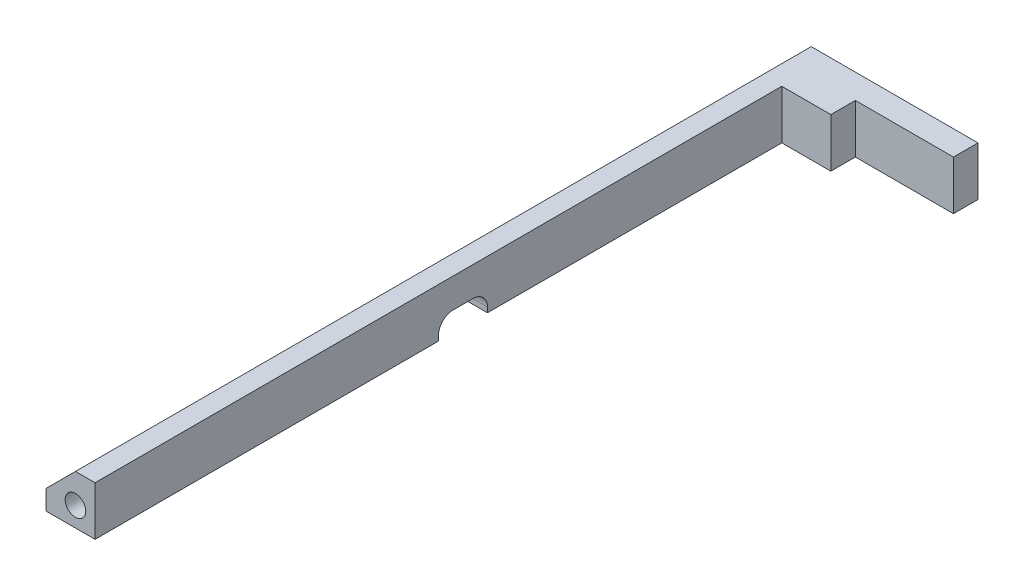
from build123d import *

# Parameters (mm, degrees)
DODANIE_WYCI_GNI_CIE1_DEPTH = 10
SZKIC2_R                    = 2.1
WYTNIJ_WYCI_GNI_CIE1_DEPTH  = 4
SZKIC3_R                    = 2.1
WYTNIJ_WYCI_GNI_CIE2_DEPTH  = 4
SFAZOWANIE1_SIZE            = 6
SZKIC4_W                    = 10
SZKIC4_H                    = 10
WYTNIJ_WYCI_GNI_CIE3_DEPTH  = 4
ZAOKR_GLENIE1_R             = 3


with BuildPart() as part:
    # Szkic1 → Dodanie-wyciągnięcie1 (new body)
    with BuildSketch(Plane(origin=(0, 0, 0), x_dir=(1, 0, 0), z_dir=(0, 1, 0))):
        Polygon((0, 0), (0, 150), (40, 150), (40, 145), (20, 145), (20, 140), (10, 140), (10, 0), align=None)
    extrude(amount=DODANIE_WYCI_GNI_CIE1_DEPTH)

    # Szkic2 → Wytnij-wyciągnięcie1 (cut)
    with BuildSketch(Plane.XZ):
        with Locations(Location((7.2, -27, 0), (0, 0, 270))):
            Circle(SZKIC2_R)
        with Locations(Location((7.2, -123, 0), (0, 0, 270))):
            Circle(SZKIC2_R)
    extrude(amount=-WYTNIJ_WYCI_GNI_CIE1_DEPTH, mode=Mode.SUBTRACT)

    # Szkic3 → Wytnij-wyciągnięcie2 (cut)
    with BuildSketch(Plane.XY):
        with Locations((6, 4)):
            Circle(SZKIC3_R)
    extrude(amount=-WYTNIJ_WYCI_GNI_CIE2_DEPTH, mode=Mode.SUBTRACT)

    # Sfazowanie1
    sfazowanie1_edges = [part.edges().sort_by_distance(p)[0] for p in [
        (0, 10, -75),
    ]]
    chamfer(sfazowanie1_edges, length=SFAZOWANIE1_SIZE)

    # Szkic4 → Wytnij-wyciągnięcie3 (cut)
    with BuildSketch(Plane.XZ):
        with Locations((5, -75)):
            Rectangle(SZKIC4_W, SZKIC4_H)
    extrude(amount=-WYTNIJ_WYCI_GNI_CIE3_DEPTH, mode=Mode.SUBTRACT)

    # Zaokrąglenie1
    zaokr_glenie1_edges = [part.edges().sort_by_distance(p)[0] for p in [
        (5, 4, -70),
        (5, 4, -80),
    ]]
    fillet(zaokr_glenie1_edges, radius=ZAOKR_GLENIE1_R)


solid = part.part
